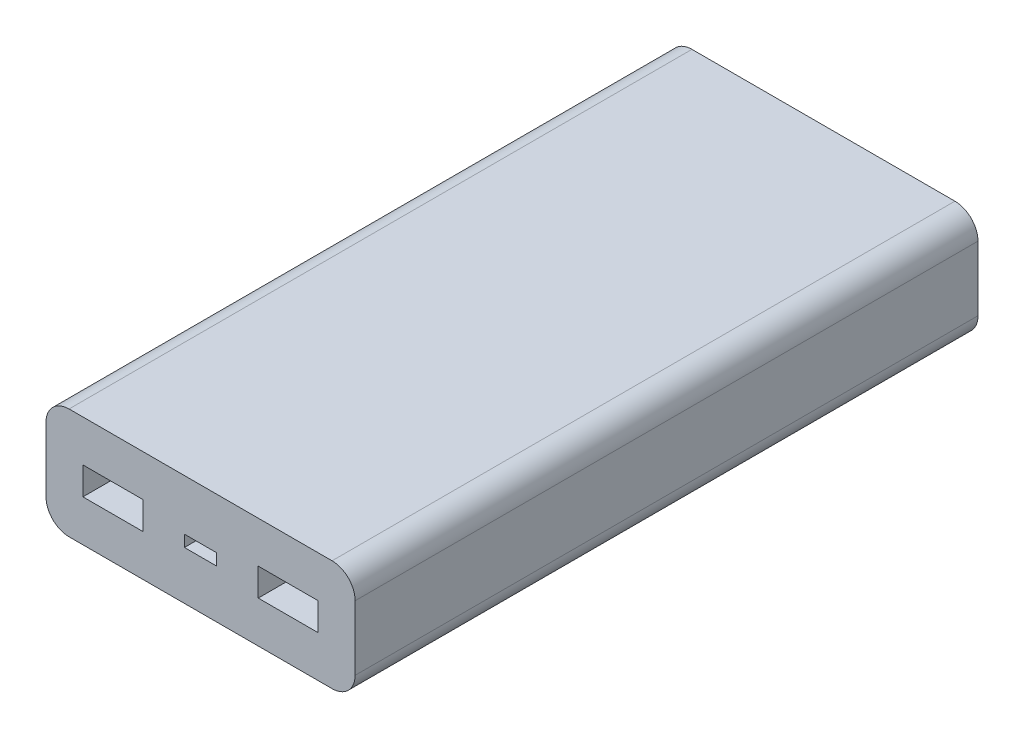
from build123d import *

# Parameters (mm, degrees)
ESQUISSE1_W             = 67
ESQUISSE1_H             = 24
BOSS_EXTRU_1_DEPTH      = 135
CONG_1_R                = 5
ESQUISSE2_W             = 13
ESQUISSE2_H             = 6
ESQUISSE2_W_2           = 7
ESQUISSE2_H_2           = 2.5
ENL_V_MAT_EXTRU_1_DEPTH = 20


with BuildPart() as part:
    # Esquisse1 → Boss.-Extru.1 (new body)
    with BuildSketch(Plane.XY):
        with Locations((33.5, 12)):
            Rectangle(ESQUISSE1_W, ESQUISSE1_H)
    extrude(amount=BOSS_EXTRU_1_DEPTH)

    # Congé1
    cong_1_edges = [part.edges().sort_by_distance(p)[0] for p in [
        (0, 24, 67.5),
        (67, 24, 67.5),
        (67, 0, 67.5),
        (0, 0, 67.5),
    ]]
    fillet(cong_1_edges, radius=CONG_1_R)

    # Esquisse2 → Enlèv. mat.-Extru.1 (cut)
    with BuildSketch(Plane.XY.offset(135)):
        with Locations((14.5, 12)):
            Rectangle(ESQUISSE2_W, ESQUISSE2_H)
        with Locations((52.5, 12)):
            Rectangle(ESQUISSE2_W, ESQUISSE2_H)
        with Locations((33.5, 11.75)):
            Rectangle(ESQUISSE2_W_2, ESQUISSE2_H_2)
    extrude(amount=-ENL_V_MAT_EXTRU_1_DEPTH, mode=Mode.SUBTRACT)


solid = part.part
